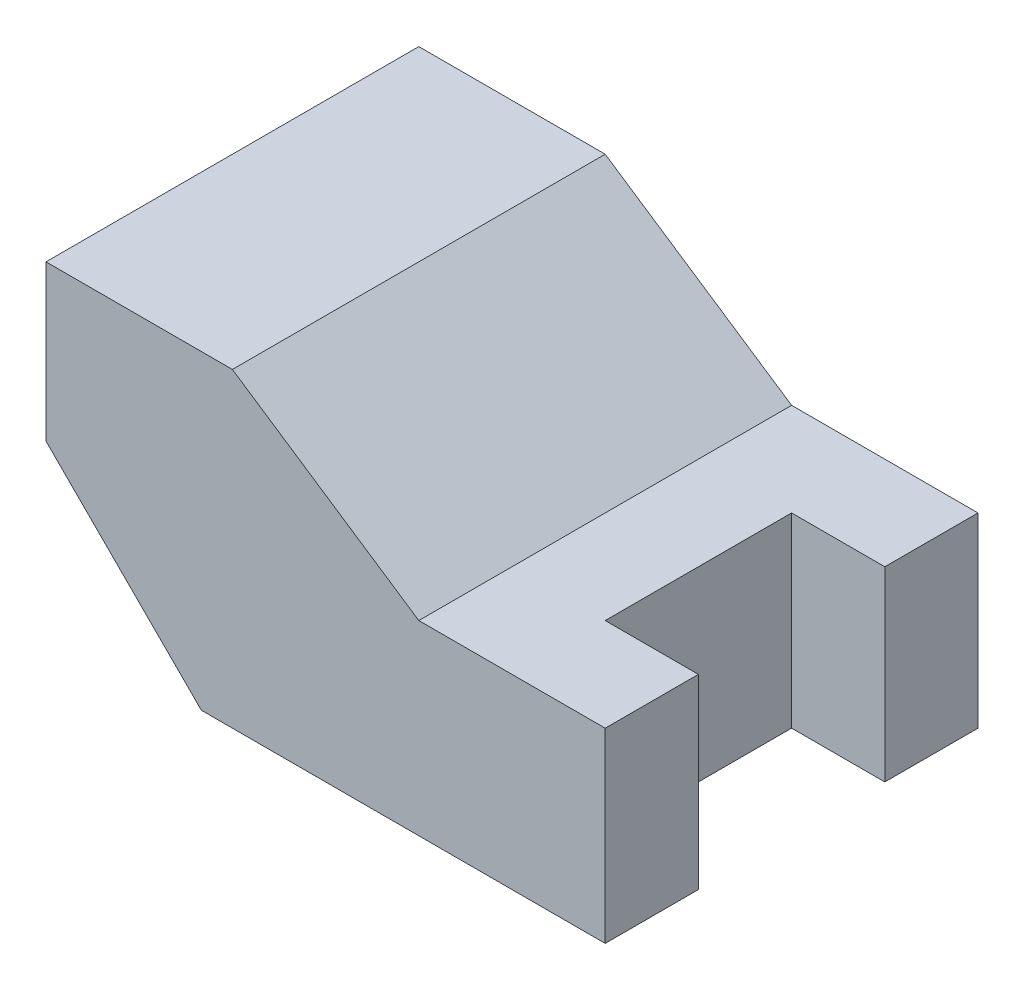
from build123d import *

# Parameters (mm, degrees)
SKETCH1_W           = 2286
SKETCH1_H           = 1270
BOSS_EXTRUDE1_DEPTH = 1524
CUT_EXTRUDE1_DEPTH  = 2009.046314207
CUT_EXTRUDE2_DEPTH  = 1524
SKETCH4_W           = 381
SKETCH4_H           = 762
CUT_EXTRUDE3_DEPTH  = 1524


with BuildPart() as part:
    # Sketch1 → Boss-Extrude1 (new body)
    with BuildSketch(Plane.XY):
        Rectangle(SKETCH1_W, SKETCH1_H)
    extrude(amount=BOSS_EXTRUDE1_DEPTH)

    # Sketch2 → Cut-Extrude1 (cut, through all)
    with BuildSketch(Plane.XY.offset(1524)):
        Polygon((-1143, 0), (-508, -635), (-1143, -635), align=None)
    extrude(amount=-CUT_EXTRUDE1_DEPTH, mode=Mode.SUBTRACT)

    # Sketch3 → Cut-Extrude2 (cut)
    with BuildSketch(Plane.XY.offset(1524)):
        Polygon((381, 127), (-381, 635), (381, 635), (1143, 635), (1143, 127), align=None)
    extrude(amount=-CUT_EXTRUDE2_DEPTH, mode=Mode.SUBTRACT)

    # Sketch4 → Cut-Extrude3 (cut)
    with BuildSketch(Plane(origin=(0, 127, 0), x_dir=(1, 0, 0), z_dir=(0, 1, 0))):
        with Locations((952.5, -762)):
            Rectangle(SKETCH4_W, SKETCH4_H)
    extrude(amount=-CUT_EXTRUDE3_DEPTH, mode=Mode.SUBTRACT)


solid = part.part
